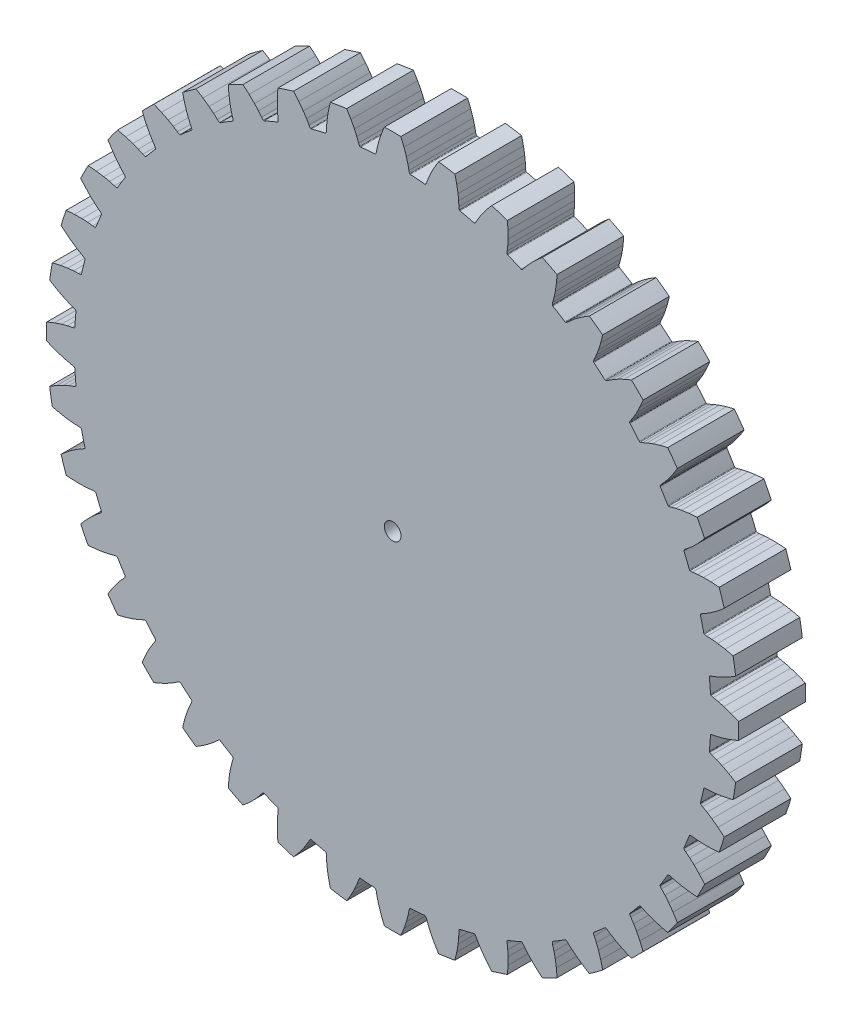
from build123d import *

# Parameters (mm, degrees)
BOSS_EXTRUDE1_DEPTH = 12.7
SKETCH2_R           = 1.5875
CUT_EXTRUDE1_DEPTH  = 95.06406823


with BuildPart() as part:
    # Model → Boss-Extrude1 (new body)
    with BuildSketch(Plane.XY):
        with BuildLine():
            ThreePointArc((60.432559989, -4.756145619), (60.482768647, -4.068159868), (60.525145286, -3.379647323))
            ThreePointArc((60.525145286, -3.379647323), (60.550130561, -3.301696422), (60.609923049, -3.245790562))
            ThreePointArc((60.609923049, -3.245790562), (60.826439878, -3.150337081), (61.055658386, -3.091602251))
            ThreePointArc((61.055658386, -3.091602251), (61.531607168, -3.002464951), (62.00435827, -2.897683768))
            ThreePointArc((62.00435827, -2.897683768), (62.546588484, -2.759880245), (63.084665609, -2.606660065))
            ThreePointArc((63.084665609, -2.606660065), (63.761308327, -2.391526525), (64.430648945, -2.154649038))
            ThreePointArc((64.430648945, -2.154649038), (65.162514979, -1.870027064), (65.885756381, -1.564152197))
            ThreePointArc((65.885756381, -1.564152197), (65.904320541, 0), (65.885756381, 1.564152197))
            ThreePointArc((65.885756381, 1.564152197), (65.162514976, 1.870027065), (64.430648939, 2.15464904))
            ThreePointArc((64.430648939, 2.15464904), (63.761308318, 2.391526528), (63.084665598, 2.606660069))
            ThreePointArc((63.084665598, 2.606660069), (62.546588471, 2.759880248), (62.004358256, 2.897683771))
            ThreePointArc((62.004358256, 2.897683771), (61.531607153, 3.002464954), (61.05565837, 3.091602254))
            ThreePointArc((61.05565837, 3.091602254), (60.82643988, 3.150337078), (60.609923065, 3.245790548))
            ThreePointArc((60.609923065, 3.245790548), (60.550130575, 3.301696402), (60.525145288, 3.379647296))
            ThreePointArc((60.525145288, 3.379647296), (60.43255999, 4.756145605), (60.308673633, 6.130180468))
            ThreePointArc((60.308673633, 6.130180468), (60.32115709, 6.211080222), (60.37146783, 6.275651394))
            ThreePointArc((60.37146783, 6.275651394), (60.570386763, 6.403800379), (60.78759506, 6.49766976))
            ThreePointArc((60.78759506, 6.49766976), (61.243739976, 6.660164425), (61.69427934, 6.837610144))
            ThreePointArc((61.69427934, 6.837610144), (62.20827658, 7.058540571), (62.715760166, 7.294048163))
            ThreePointArc((62.715760166, 7.294048163), (63.350417988, 7.612383294), (63.97446211, 7.951052367))
            ThreePointArc((63.97446211, 7.951052367), (64.652792972, 8.346659244), (65.319280701, 8.761908165))
            ThreePointArc((65.319280701, 8.761908165), (65.092928993, 10.309707128), (64.829906076, 11.851697941))
            ThreePointArc((64.829906076, 11.851697941), (64.067719602, 12.0406671), (63.300339364, 12.207295834))
            ThreePointArc((63.300339364, 12.207295834), (62.602183634, 12.336549025), (61.900217208, 12.443183673))
            ThreePointArc((61.900217208, 12.443183673), (61.344795787, 12.51034365), (60.787684105, 12.56162709))
            ThreePointArc((60.787684105, 12.56162709), (60.304361964, 12.591163676), (59.820328755, 12.604748755))
            ThreePointArc((59.820328755, 12.604748755), (59.584744174, 12.626902784), (59.355960828, 12.687310371))
            ThreePointArc((59.355960828, 12.687310371), (59.28815888, 12.733174325), (59.251286997, 12.806256954))
            ThreePointArc((59.251286997, 12.806256954), (58.944509801, 14.151324754), (58.607202282, 15.489062871))
            ThreePointArc((58.607202282, 15.489062871), (58.606876537, 15.570919457), (58.646466712, 15.642565985))
            ThreePointArc((58.646466712, 15.642565985), (58.822889705, 15.800255021), (59.0227394, 15.926947577))
            ThreePointArc((59.0227394, 15.926947577), (59.44784865, 16.158798449), (59.8650825, 16.404539401))
            ThreePointArc((59.8650825, 16.404539401), (60.338190448, 16.703156691), (60.802584565, 17.015152717))
            ThreePointArc((60.802584565, 17.015152717), (61.379630111, 17.428850971), (61.943011698, 17.860972475))
            ThreePointArc((61.943011698, 17.860972475), (62.551104632, 18.3578231), (63.144427548, 18.872221269))
            ThreePointArc((63.144427548, 18.872221269), (62.678733503, 20.36555505), (62.177728326, 21.847415549))
            ThreePointArc((62.177728326, 21.847415549), (61.395364343, 21.91482595), (60.611365352, 21.959358491))
            ThreePointArc((60.611365352, 21.959358491), (59.901585424, 21.977804742), (59.191580035, 21.973314798))
            ThreePointArc((59.191580035, 21.973314798), (58.632490638, 21.952760872), (58.074215428, 21.916261459))
            ThreePointArc((58.074215428, 21.916261459), (57.592223245, 21.869826161), (57.112024113, 21.807524509))
            ThreePointArc((57.112024113, 21.807524509), (56.875874316, 21.792552237), (56.640457844, 21.816426506))
            ThreePointArc((56.640457844, 21.816426506), (56.566315947, 21.851119237), (56.518465376, 21.917534065))
            ThreePointArc((56.518465376, 21.917534065), (56.005050155, 23.198051321), (55.462627105, 24.466553141))
            ThreePointArc((55.462627105, 24.466553141), (55.449500179, 24.547350979), (55.477394947, 24.624308687))
            ThreePointArc((55.477394947, 24.624308687), (55.62697788, 24.807654946), (55.804548012, 24.964051086))
            ThreePointArc((55.804548012, 24.964051086), (56.188153994, 25.259549228), (56.561808649, 25.567534455))
            ThreePointArc((56.561808649, 25.567534455), (56.982377817, 25.936485659), (57.39224754, 26.317287741))
            ThreePointArc((57.39224754, 26.317287741), (57.897472032, 26.816162495), (58.386318762, 27.331096163))
            ThreePointArc((58.386318762, 27.331096163), (58.9092005, 27.916956425), (59.414749024, 28.517837652))
            ThreePointArc((59.414749024, 28.517837652), (58.721179574, 29.919935417), (57.994528549, 31.305177278))
            ThreePointArc((57.994528549, 31.305177278), (57.211251454, 31.249369054), (56.429938368, 31.170708862))
            ThreePointArc((56.429938368, 31.170708862), (55.726011378, 31.077893966), (55.025449716, 30.962389988))
            ThreePointArc((55.025449716, 30.962389988), (54.47645898, 30.854628264), (53.930766831, 30.731244736))
            ThreePointArc((53.930766831, 30.731244736), (53.461972852, 30.609980944), (52.997431894, 30.473326634))
            ThreePointArc((52.997431894, 30.473326634), (52.766531672, 30.421596728), (52.530278809, 30.408349816))
            ThreePointArc((52.530278809, 30.408349816), (52.451622583, 30.431017074), (52.393971564, 30.489128746))
            ThreePointArc((52.393971564, 30.489128746), (51.686560304, 31.673564875), (50.952377978, 32.841595673))
            ThreePointArc((50.952377978, 32.841595673), (50.9267731, 32.919345252), (50.942285599, 32.999719186))
            ThreePointArc((50.942285599, 32.999719186), (51.061345244, 33.204208074), (51.212263446, 33.386456807))
            ThreePointArc((51.212263446, 33.386456807), (51.544920509, 33.738326073), (51.865795351, 34.100971957))
            ThreePointArc((51.865795351, 34.100971957), (52.22346993, 34.531172272), (52.568722907, 34.9714038))
            ThreePointArc((52.568722907, 34.9714038), (52.989686042, 35.5431711), (53.391960884, 36.128237557))
            ThreePointArc((53.391960884, 36.128237557), (53.816756344, 36.788681632), (54.222082193, 37.461250227))
            ThreePointArc((54.222082193, 37.461250227), (53.31771532, 38.737587676), (52.383311005, 39.992101646))
            ThreePointArc((52.383311005, 39.992101646), (51.618407681, 39.814448981), (50.859019021, 39.614532932))
            ThreePointArc((50.859019021, 39.614532932), (50.178277989, 39.4127423), (49.504410207, 39.189068378))
            ThreePointArc((49.504410207, 39.189068378), (48.979036105, 38.996752308), (48.459363768, 38.789522776))
            ThreePointArc((48.459363768, 38.789522776), (48.015311257, 38.596416407), (47.577867013, 38.388774323))
            ThreePointArc((47.577867013, 38.388774323), (47.357901896, 38.301560545), (47.126629971, 38.251518634))
            ThreePointArc((47.126629971, 38.251518634), (47.045396194, 38.261602276), (46.979364286, 38.309979891))
            ThreePointArc((46.979364286, 38.309979891), (46.095375801, 39.369170143), (45.187512204, 40.407969124))
            ThreePointArc((45.187512204, 40.407969124), (45.150059851, 40.480755991), (45.152808112, 40.562567078))
            ThreePointArc((45.152808112, 40.562567078), (45.238412826, 40.783163401), (45.358962991, 40.986777158))
            ThreePointArc((45.358962991, 40.986777158), (45.632480013, 41.386353359), (45.892674038, 41.794730354))
            ThreePointArc((45.892674038, 41.794730354), (46.178646894, 42.275586821), (46.45078185, 42.764407833))
            ThreePointArc((46.45078185, 42.764407833), (46.777118118, 43.394988872), (47.082915731, 44.03578184))
            ThreePointArc((47.082915731, 44.03578184), (47.399165039, 44.754547403), (47.694287746, 45.482242495))
            ThreePointArc((47.694287746, 45.482242495), (46.601391964, 46.601391964), (45.482242495, 47.694287746))
            ThreePointArc((45.482242495, 47.694287746), (44.7545474, 47.399165038), (44.035781834, 47.082915728))
            ThreePointArc((44.035781834, 47.082915728), (43.394988864, 46.777118114), (42.764407822, 46.450781844))
            ThreePointArc((42.764407822, 46.450781844), (42.275586809, 46.178646887), (41.794730341, 45.89267403))
            ThreePointArc((41.794730341, 45.89267403), (41.386353346, 45.632480004), (40.986777145, 45.358962982))
            ThreePointArc((40.986777145, 45.358962982), (40.783163404, 45.238412825), (40.5625671, 45.152808114))
            ThreePointArc((40.5625671, 45.152808114), (40.480756016, 45.150059846), (40.407969144, 45.187512186))
            ThreePointArc((40.407969144, 45.187512186), (39.369170163, 46.095375783), (38.309979911, 46.979364269))
            ThreePointArc((38.309979911, 46.979364269), (38.261602284, 47.04539617), (38.251518636, 47.12662995))
            ThreePointArc((38.251518636, 47.12662995), (38.301560546, 47.357901893), (38.38877433, 47.577867028))
            ThreePointArc((38.38877433, 47.577867028), (38.596416414, 48.015311271), (38.789522782, 48.459363781))
            ThreePointArc((38.789522782, 48.459363781), (38.996752313, 48.979036118), (39.189068382, 49.504410218))
            ThreePointArc((39.189068382, 49.504410218), (39.412742303, 50.178277998), (39.614532934, 50.859019027))
            ThreePointArc((39.614532934, 50.859019027), (39.814448982, 51.618407685), (39.992101646, 52.383311005))
            ThreePointArc((39.992101646, 52.383311005), (38.737587676, 53.31771532), (37.461250227, 54.222082193))
            ThreePointArc((37.461250227, 54.222082193), (36.788681629, 53.816756342), (36.128237552, 53.39196088))
            ThreePointArc((36.128237552, 53.39196088), (35.543171093, 52.989686036), (34.97140379, 52.568722899))
            ThreePointArc((34.97140379, 52.568722899), (34.531172261, 52.223469921), (34.100971945, 51.865795341))
            ThreePointArc((34.100971945, 51.865795341), (33.738326061, 51.544920498), (33.386456796, 51.212263435))
            ThreePointArc((33.386456796, 51.212263435), (33.204208077, 51.061345244), (32.999719207, 50.942285604))
            ThreePointArc((32.999719207, 50.942285604), (32.919345277, 50.926773099), (32.841595695, 50.952377963))
            ThreePointArc((32.841595695, 50.952377963), (31.673564898, 51.68656029), (30.48912877, 52.39397155))
            ThreePointArc((30.48912877, 52.39397155), (30.431017086, 52.451622561), (30.408349821, 52.530278788))
            ThreePointArc((30.408349821, 52.530278788), (30.42159673, 52.766531669), (30.473326639, 52.997431909))
            ThreePointArc((30.473326639, 52.997431909), (30.609980948, 53.461972867), (30.731244739, 53.930766845))
            ThreePointArc((30.731244739, 53.930766845), (30.854628267, 54.476458994), (30.96238999, 55.025449729))
            ThreePointArc((30.96238999, 55.025449729), (31.077893968, 55.726011388), (31.170708863, 56.429938375))
            ThreePointArc((31.170708863, 56.429938375), (31.249369054, 57.211251458), (31.305177278, 57.994528549))
            ThreePointArc((31.305177278, 57.994528549), (29.919935417, 58.721179574), (28.517837652, 59.414749024))
            ThreePointArc((28.517837652, 59.414749024), (27.916956423, 58.909200498), (27.331096158, 58.386318757))
            ThreePointArc((27.331096158, 58.386318757), (26.816162488, 57.897472026), (26.317287733, 57.392247531))
            ThreePointArc((26.317287733, 57.392247531), (25.93648565, 56.982377807), (25.567534445, 56.561808638))
            ThreePointArc((25.567534445, 56.561808638), (25.259549218, 56.188153982), (24.964051077, 55.804547999))
            ThreePointArc((24.964051077, 55.804547999), (24.807654948, 55.626977881), (24.624308707, 55.477394955))
            ThreePointArc((24.624308707, 55.477394955), (24.547351004, 55.449500182), (24.466553165, 55.462627094))
            ThreePointArc((24.466553165, 55.462627094), (23.198051346, 56.005050144), (21.91753409, 56.518465366))
            ThreePointArc((21.91753409, 56.518465366), (21.851119252, 56.566315927), (21.816426515, 56.640457824))
            ThreePointArc((21.816426515, 56.640457824), (21.792552239, 56.875874313), (21.807524511, 57.112024129))
            ThreePointArc((21.807524511, 57.112024129), (21.869826163, 57.59222326), (21.91626146, 58.074215443))
            ThreePointArc((21.91626146, 58.074215443), (21.952760873, 58.632490652), (21.973314799, 59.191580047))
            ThreePointArc((21.973314799, 59.191580047), (21.977804742, 59.901585433), (21.95935849, 60.611365359))
            ThreePointArc((21.95935849, 60.611365359), (21.91482595, 61.395364346), (21.847415549, 62.177728326))
            ThreePointArc((21.847415549, 62.177728326), (20.36555505, 62.678733503), (18.872221269, 63.144427548))
            ThreePointArc((18.872221269, 63.144427548), (18.357823098, 62.551104629), (17.860972471, 61.943011693))
            ThreePointArc((17.860972471, 61.943011693), (17.428850966, 61.379630103), (17.01515271, 60.802584555))
            ThreePointArc((17.01515271, 60.802584555), (16.703156684, 60.338190437), (16.404539394, 59.865082488))
            ThreePointArc((16.404539394, 59.865082488), (16.158798442, 59.447848637), (15.92694757, 59.022739386))
            ThreePointArc((15.92694757, 59.022739386), (15.800255024, 58.822889706), (15.642566004, 58.646466723))
            ThreePointArc((15.642566004, 58.646466723), (15.570919481, 58.606876544), (15.489062897, 58.607202275))
            ThreePointArc((15.489062897, 58.607202275), (14.15132478, 58.944509794), (12.806256981, 59.251286991))
            ThreePointArc((12.806256981, 59.251286991), (12.733174343, 59.288158863), (12.687310383, 59.35596081))
            ThreePointArc((12.687310383, 59.35596081), (12.626902786, 59.584744172), (12.604748755, 59.820328771))
            ThreePointArc((12.604748755, 59.820328771), (12.591163676, 60.304361979), (12.561627088, 60.78768412))
            ThreePointArc((12.561627088, 60.78768412), (12.510343649, 61.3447958), (12.443183671, 61.90021722))
            ThreePointArc((12.443183671, 61.90021722), (12.336549023, 62.602183643), (12.207295833, 63.300339371))
            ThreePointArc((12.207295833, 63.300339371), (12.040667099, 64.067719605), (11.851697941, 64.829906076))
            ThreePointArc((11.851697941, 64.829906076), (10.309707128, 65.092928993), (8.761908165, 65.319280701))
            ThreePointArc((8.761908165, 65.319280701), (8.346659242, 64.652792969), (7.951052364, 63.974462104))
            ThreePointArc((7.951052364, 63.974462104), (7.612383289, 63.35041798), (7.294048157, 62.715760155))
            ThreePointArc((7.294048157, 62.715760155), (7.058540565, 62.208276567), (6.837610138, 61.694279326))
            ThreePointArc((6.837610138, 61.694279326), (6.66016442, 61.243739962), (6.497669755, 60.787595044))
            ThreePointArc((6.497669755, 60.787595044), (6.403800382, 60.570386765), (6.27565141, 60.371467844))
            ThreePointArc((6.27565141, 60.371467844), (6.211080244, 60.3211571), (6.130180495, 60.30867363))
            ThreePointArc((6.130180495, 60.30867363), (4.756145632, 60.432559988), (3.379647323, 60.525145286))
            ThreePointArc((3.379647323, 60.525145286), (3.301696422, 60.550130561), (3.245790562, 60.609923049))
            ThreePointArc((3.245790562, 60.609923049), (3.150337081, 60.826439878), (3.091602251, 61.055658386))
            ThreePointArc((3.091602251, 61.055658386), (3.002464951, 61.531607168), (2.897683768, 62.00435827))
            ThreePointArc((2.897683768, 62.00435827), (2.759880245, 62.546588484), (2.606660065, 63.084665609))
            ThreePointArc((2.606660065, 63.084665609), (2.391526525, 63.761308327), (2.154649038, 64.430648945))
            ThreePointArc((2.154649038, 64.430648945), (1.870027064, 65.162514979), (1.564152197, 65.885756381))
            ThreePointArc((1.564152197, 65.885756381), (0, 65.904320541), (-1.564152197, 65.885756381))
            ThreePointArc((-1.564152197, 65.885756381), (-1.870027065, 65.162514976), (-2.15464904, 64.430648939))
            ThreePointArc((-2.15464904, 64.430648939), (-2.391526528, 63.761308318), (-2.606660069, 63.084665598))
            ThreePointArc((-2.606660069, 63.084665598), (-2.759880248, 62.546588471), (-2.897683771, 62.004358256))
            ThreePointArc((-2.897683771, 62.004358256), (-3.002464954, 61.531607153), (-3.091602254, 61.05565837))
            ThreePointArc((-3.091602254, 61.05565837), (-3.150337078, 60.82643988), (-3.245790548, 60.609923065))
            ThreePointArc((-3.245790548, 60.609923065), (-3.301696402, 60.550130575), (-3.379647296, 60.525145288))
            ThreePointArc((-3.379647296, 60.525145288), (-4.756145605, 60.43255999), (-6.130180468, 60.308673633))
            ThreePointArc((-6.130180468, 60.308673633), (-6.211080222, 60.32115709), (-6.275651394, 60.37146783))
            ThreePointArc((-6.275651394, 60.37146783), (-6.403800379, 60.570386763), (-6.49766976, 60.78759506))
            ThreePointArc((-6.49766976, 60.78759506), (-6.660164425, 61.243739976), (-6.837610144, 61.69427934))
            ThreePointArc((-6.837610144, 61.69427934), (-7.058540571, 62.20827658), (-7.294048163, 62.715760166))
            ThreePointArc((-7.294048163, 62.715760166), (-7.612383294, 63.350417988), (-7.951052367, 63.97446211))
            ThreePointArc((-7.951052367, 63.97446211), (-8.346659244, 64.652792972), (-8.761908165, 65.319280701))
            ThreePointArc((-8.761908165, 65.319280701), (-10.309707128, 65.092928993), (-11.851697941, 64.829906076))
            ThreePointArc((-11.851697941, 64.829906076), (-12.0406671, 64.067719602), (-12.207295834, 63.300339364))
            ThreePointArc((-12.207295834, 63.300339364), (-12.336549025, 62.602183634), (-12.443183673, 61.900217208))
            ThreePointArc((-12.443183673, 61.900217208), (-12.51034365, 61.344795787), (-12.56162709, 60.787684105))
            ThreePointArc((-12.56162709, 60.787684105), (-12.591163676, 60.304361964), (-12.604748755, 59.820328755))
            ThreePointArc((-12.604748755, 59.820328755), (-12.626902784, 59.584744174), (-12.687310371, 59.355960828))
            ThreePointArc((-12.687310371, 59.355960828), (-12.733174325, 59.28815888), (-12.806256954, 59.251286997))
            ThreePointArc((-12.806256954, 59.251286997), (-14.151324754, 58.944509801), (-15.489062871, 58.607202282))
            ThreePointArc((-15.489062871, 58.607202282), (-15.570919457, 58.606876537), (-15.642565985, 58.646466712))
            ThreePointArc((-15.642565985, 58.646466712), (-15.800255021, 58.822889705), (-15.926947577, 59.0227394))
            ThreePointArc((-15.926947577, 59.0227394), (-16.158798449, 59.44784865), (-16.404539401, 59.8650825))
            ThreePointArc((-16.404539401, 59.8650825), (-16.703156691, 60.338190448), (-17.015152717, 60.802584565))
            ThreePointArc((-17.015152717, 60.802584565), (-17.428850971, 61.379630111), (-17.860972475, 61.943011698))
            ThreePointArc((-17.860972475, 61.943011698), (-18.3578231, 62.551104632), (-18.872221269, 63.144427548))
            ThreePointArc((-18.872221269, 63.144427548), (-20.36555505, 62.678733503), (-21.847415549, 62.177728326))
            ThreePointArc((-21.847415549, 62.177728326), (-21.91482595, 61.395364343), (-21.959358491, 60.611365352))
            ThreePointArc((-21.959358491, 60.611365352), (-21.977804742, 59.901585424), (-21.973314798, 59.191580035))
            ThreePointArc((-21.973314798, 59.191580035), (-21.952760872, 58.632490638), (-21.916261459, 58.074215428))
            ThreePointArc((-21.916261459, 58.074215428), (-21.869826161, 57.592223245), (-21.807524509, 57.112024113))
            ThreePointArc((-21.807524509, 57.112024113), (-21.792552237, 56.875874316), (-21.816426506, 56.640457844))
            ThreePointArc((-21.816426506, 56.640457844), (-21.851119237, 56.566315947), (-21.917534065, 56.518465376))
            ThreePointArc((-21.917534065, 56.518465376), (-23.198051321, 56.005050155), (-24.466553141, 55.462627105))
            ThreePointArc((-24.466553141, 55.462627105), (-24.547350979, 55.449500179), (-24.624308687, 55.477394947))
            ThreePointArc((-24.624308687, 55.477394947), (-24.807654946, 55.62697788), (-24.964051086, 55.804548012))
            ThreePointArc((-24.964051086, 55.804548012), (-25.259549228, 56.188153994), (-25.567534455, 56.561808649))
            ThreePointArc((-25.567534455, 56.561808649), (-25.936485659, 56.982377817), (-26.317287741, 57.39224754))
            ThreePointArc((-26.317287741, 57.39224754), (-26.816162495, 57.897472032), (-27.331096163, 58.386318762))
            ThreePointArc((-27.331096163, 58.386318762), (-27.916956425, 58.9092005), (-28.517837652, 59.414749024))
            ThreePointArc((-28.517837652, 59.414749024), (-29.919935417, 58.721179574), (-31.305177278, 57.994528549))
            ThreePointArc((-31.305177278, 57.994528549), (-31.249369054, 57.211251454), (-31.170708862, 56.429938368))
            ThreePointArc((-31.170708862, 56.429938368), (-31.077893966, 55.726011378), (-30.962389988, 55.025449716))
            ThreePointArc((-30.962389988, 55.025449716), (-30.854628264, 54.47645898), (-30.731244736, 53.930766831))
            ThreePointArc((-30.731244736, 53.930766831), (-30.609980944, 53.461972852), (-30.473326634, 52.997431894))
            ThreePointArc((-30.473326634, 52.997431894), (-30.421596728, 52.766531672), (-30.408349816, 52.530278809))
            ThreePointArc((-30.408349816, 52.530278809), (-30.431017074, 52.451622583), (-30.489128746, 52.393971564))
            ThreePointArc((-30.489128746, 52.393971564), (-31.673564875, 51.686560304), (-32.841595673, 50.952377978))
            ThreePointArc((-32.841595673, 50.952377978), (-32.919345252, 50.9267731), (-32.999719186, 50.942285599))
            ThreePointArc((-32.999719186, 50.942285599), (-33.204208074, 51.061345244), (-33.386456807, 51.212263446))
            ThreePointArc((-33.386456807, 51.212263446), (-33.738326073, 51.544920509), (-34.100971957, 51.865795351))
            ThreePointArc((-34.100971957, 51.865795351), (-34.531172272, 52.22346993), (-34.9714038, 52.568722907))
            ThreePointArc((-34.9714038, 52.568722907), (-35.5431711, 52.989686042), (-36.128237557, 53.391960884))
            ThreePointArc((-36.128237557, 53.391960884), (-36.788681632, 53.816756344), (-37.461250227, 54.222082193))
            ThreePointArc((-37.461250227, 54.222082193), (-38.737587676, 53.31771532), (-39.992101646, 52.383311005))
            ThreePointArc((-39.992101646, 52.383311005), (-39.814448981, 51.618407681), (-39.614532932, 50.859019021))
            ThreePointArc((-39.614532932, 50.859019021), (-39.4127423, 50.178277989), (-39.189068378, 49.504410207))
            ThreePointArc((-39.189068378, 49.504410207), (-38.996752308, 48.979036105), (-38.789522776, 48.459363768))
            ThreePointArc((-38.789522776, 48.459363768), (-38.596416407, 48.015311257), (-38.388774323, 47.577867013))
            ThreePointArc((-38.388774323, 47.577867013), (-38.301560545, 47.357901896), (-38.251518634, 47.126629971))
            ThreePointArc((-38.251518634, 47.126629971), (-38.261602276, 47.045396194), (-38.309979891, 46.979364286))
            ThreePointArc((-38.309979891, 46.979364286), (-39.369170143, 46.095375801), (-40.407969124, 45.187512204))
            ThreePointArc((-40.407969124, 45.187512204), (-40.480755991, 45.150059851), (-40.562567078, 45.152808112))
            ThreePointArc((-40.562567078, 45.152808112), (-40.783163401, 45.238412826), (-40.986777158, 45.358962991))
            ThreePointArc((-40.986777158, 45.358962991), (-41.386353359, 45.632480013), (-41.794730354, 45.892674038))
            ThreePointArc((-41.794730354, 45.892674038), (-42.275586821, 46.178646894), (-42.764407833, 46.45078185))
            ThreePointArc((-42.764407833, 46.45078185), (-43.394988872, 46.777118118), (-44.03578184, 47.082915731))
            ThreePointArc((-44.03578184, 47.082915731), (-44.754547403, 47.399165039), (-45.482242495, 47.694287746))
            ThreePointArc((-45.482242495, 47.694287746), (-46.601391964, 46.601391964), (-47.694287746, 45.482242495))
            ThreePointArc((-47.694287746, 45.482242495), (-47.399165038, 44.7545474), (-47.082915728, 44.035781834))
            ThreePointArc((-47.082915728, 44.035781834), (-46.777118114, 43.394988864), (-46.450781844, 42.764407822))
            ThreePointArc((-46.450781844, 42.764407822), (-46.178646887, 42.275586809), (-45.89267403, 41.794730341))
            ThreePointArc((-45.89267403, 41.794730341), (-45.632480004, 41.386353346), (-45.358962982, 40.986777145))
            ThreePointArc((-45.358962982, 40.986777145), (-45.238412825, 40.783163404), (-45.152808114, 40.5625671))
            ThreePointArc((-45.152808114, 40.5625671), (-45.150059846, 40.480756016), (-45.187512186, 40.407969144))
            ThreePointArc((-45.187512186, 40.407969144), (-46.095375783, 39.369170163), (-46.979364269, 38.309979911))
            ThreePointArc((-46.979364269, 38.309979911), (-47.04539617, 38.261602284), (-47.12662995, 38.251518636))
            ThreePointArc((-47.12662995, 38.251518636), (-47.357901893, 38.301560546), (-47.577867028, 38.38877433))
            ThreePointArc((-47.577867028, 38.38877433), (-48.015311271, 38.596416414), (-48.459363781, 38.789522782))
            ThreePointArc((-48.459363781, 38.789522782), (-48.979036118, 38.996752313), (-49.504410218, 39.189068382))
            ThreePointArc((-49.504410218, 39.189068382), (-50.178277998, 39.412742303), (-50.859019027, 39.614532934))
            ThreePointArc((-50.859019027, 39.614532934), (-51.618407685, 39.814448982), (-52.383311005, 39.992101646))
            ThreePointArc((-52.383311005, 39.992101646), (-53.31771532, 38.737587676), (-54.222082193, 37.461250227))
            ThreePointArc((-54.222082193, 37.461250227), (-53.816756342, 36.788681629), (-53.39196088, 36.128237552))
            ThreePointArc((-53.39196088, 36.128237552), (-52.989686036, 35.543171093), (-52.568722899, 34.97140379))
            ThreePointArc((-52.568722899, 34.97140379), (-52.223469921, 34.531172261), (-51.865795341, 34.100971945))
            ThreePointArc((-51.865795341, 34.100971945), (-51.544920498, 33.738326061), (-51.212263435, 33.386456796))
            ThreePointArc((-51.212263435, 33.386456796), (-51.061345244, 33.204208077), (-50.942285604, 32.999719207))
            ThreePointArc((-50.942285604, 32.999719207), (-50.926773099, 32.919345277), (-50.952377963, 32.841595695))
            ThreePointArc((-50.952377963, 32.841595695), (-51.68656029, 31.673564898), (-52.39397155, 30.48912877))
            ThreePointArc((-52.39397155, 30.48912877), (-52.451622561, 30.431017086), (-52.530278788, 30.408349821))
            ThreePointArc((-52.530278788, 30.408349821), (-52.766531669, 30.42159673), (-52.997431909, 30.473326639))
            ThreePointArc((-52.997431909, 30.473326639), (-53.461972867, 30.609980948), (-53.930766845, 30.731244739))
            ThreePointArc((-53.930766845, 30.731244739), (-54.476458994, 30.854628267), (-55.025449729, 30.96238999))
            ThreePointArc((-55.025449729, 30.96238999), (-55.726011388, 31.077893968), (-56.429938375, 31.170708863))
            ThreePointArc((-56.429938375, 31.170708863), (-57.211251458, 31.249369054), (-57.994528549, 31.305177278))
            ThreePointArc((-57.994528549, 31.305177278), (-58.721179574, 29.919935417), (-59.414749024, 28.517837652))
            ThreePointArc((-59.414749024, 28.517837652), (-58.909200498, 27.916956423), (-58.386318757, 27.331096158))
            ThreePointArc((-58.386318757, 27.331096158), (-57.897472026, 26.816162488), (-57.392247531, 26.317287733))
            ThreePointArc((-57.392247531, 26.317287733), (-56.982377807, 25.93648565), (-56.561808638, 25.567534445))
            ThreePointArc((-56.561808638, 25.567534445), (-56.188153982, 25.259549218), (-55.804547999, 24.964051077))
            ThreePointArc((-55.804547999, 24.964051077), (-55.626977881, 24.807654948), (-55.477394955, 24.624308707))
            ThreePointArc((-55.477394955, 24.624308707), (-55.449500182, 24.547351004), (-55.462627094, 24.466553165))
            ThreePointArc((-55.462627094, 24.466553165), (-56.005050144, 23.198051346), (-56.518465366, 21.91753409))
            ThreePointArc((-56.518465366, 21.91753409), (-56.566315927, 21.851119252), (-56.640457824, 21.816426515))
            ThreePointArc((-56.640457824, 21.816426515), (-56.875874313, 21.792552239), (-57.112024129, 21.807524511))
            ThreePointArc((-57.112024129, 21.807524511), (-57.59222326, 21.869826163), (-58.074215443, 21.91626146))
            ThreePointArc((-58.074215443, 21.91626146), (-58.632490652, 21.952760873), (-59.191580047, 21.973314799))
            ThreePointArc((-59.191580047, 21.973314799), (-59.901585433, 21.977804742), (-60.611365359, 21.95935849))
            ThreePointArc((-60.611365359, 21.95935849), (-61.395364346, 21.91482595), (-62.177728326, 21.847415549))
            ThreePointArc((-62.177728326, 21.847415549), (-62.678733503, 20.36555505), (-63.144427548, 18.872221269))
            ThreePointArc((-63.144427548, 18.872221269), (-62.551104629, 18.357823098), (-61.943011693, 17.860972471))
            ThreePointArc((-61.943011693, 17.860972471), (-61.379630103, 17.428850966), (-60.802584555, 17.01515271))
            ThreePointArc((-60.802584555, 17.01515271), (-60.338190437, 16.703156684), (-59.865082488, 16.404539394))
            ThreePointArc((-59.865082488, 16.404539394), (-59.447848637, 16.158798442), (-59.022739386, 15.92694757))
            ThreePointArc((-59.022739386, 15.92694757), (-58.822889706, 15.800255024), (-58.646466723, 15.642566004))
            ThreePointArc((-58.646466723, 15.642566004), (-58.606876544, 15.570919481), (-58.607202275, 15.489062897))
            ThreePointArc((-58.607202275, 15.489062897), (-58.944509794, 14.15132478), (-59.251286991, 12.806256981))
            ThreePointArc((-59.251286991, 12.806256981), (-59.288158863, 12.733174343), (-59.35596081, 12.687310383))
            ThreePointArc((-59.35596081, 12.687310383), (-59.584744172, 12.626902786), (-59.820328771, 12.604748755))
            ThreePointArc((-59.820328771, 12.604748755), (-60.304361979, 12.591163676), (-60.78768412, 12.561627088))
            ThreePointArc((-60.78768412, 12.561627088), (-61.3447958, 12.510343649), (-61.90021722, 12.443183671))
            ThreePointArc((-61.90021722, 12.443183671), (-62.602183643, 12.336549023), (-63.300339371, 12.207295833))
            ThreePointArc((-63.300339371, 12.207295833), (-64.067719605, 12.040667099), (-64.829906076, 11.851697941))
            ThreePointArc((-64.829906076, 11.851697941), (-65.092928993, 10.309707128), (-65.319280701, 8.761908165))
            ThreePointArc((-65.319280701, 8.761908165), (-64.652792969, 8.346659242), (-63.974462104, 7.951052364))
            ThreePointArc((-63.974462104, 7.951052364), (-63.35041798, 7.612383289), (-62.715760155, 7.294048157))
            ThreePointArc((-62.715760155, 7.294048157), (-62.208276567, 7.058540565), (-61.694279326, 6.837610138))
            ThreePointArc((-61.694279326, 6.837610138), (-61.243739962, 6.66016442), (-60.787595044, 6.497669755))
            ThreePointArc((-60.787595044, 6.497669755), (-60.570386765, 6.403800382), (-60.371467844, 6.27565141))
            ThreePointArc((-60.371467844, 6.27565141), (-60.3211571, 6.211080244), (-60.30867363, 6.130180495))
            ThreePointArc((-60.30867363, 6.130180495), (-60.432559988, 4.756145632), (-60.525145286, 3.379647323))
            ThreePointArc((-60.525145286, 3.379647323), (-60.550130561, 3.301696422), (-60.609923049, 3.245790562))
            ThreePointArc((-60.609923049, 3.245790562), (-60.826439878, 3.150337081), (-61.055658386, 3.091602251))
            ThreePointArc((-61.055658386, 3.091602251), (-61.531607168, 3.002464951), (-62.00435827, 2.897683768))
            ThreePointArc((-62.00435827, 2.897683768), (-62.546588484, 2.759880245), (-63.084665609, 2.606660065))
            ThreePointArc((-63.084665609, 2.606660065), (-63.761308327, 2.391526525), (-64.430648945, 2.154649038))
            ThreePointArc((-64.430648945, 2.154649038), (-65.162514979, 1.870027064), (-65.885756381, 1.564152197))
            ThreePointArc((-65.885756381, 1.564152197), (-65.904320541, 0), (-65.885756381, -1.564152197))
            ThreePointArc((-65.885756381, -1.564152197), (-65.162514976, -1.870027065), (-64.430648939, -2.15464904))
            ThreePointArc((-64.430648939, -2.15464904), (-63.761308318, -2.391526528), (-63.084665598, -2.606660069))
            ThreePointArc((-63.084665598, -2.606660069), (-62.546588471, -2.759880248), (-62.004358256, -2.897683771))
            ThreePointArc((-62.004358256, -2.897683771), (-61.531607153, -3.002464954), (-61.05565837, -3.091602254))
            ThreePointArc((-61.05565837, -3.091602254), (-60.82643988, -3.150337078), (-60.609923065, -3.245790548))
            ThreePointArc((-60.609923065, -3.245790548), (-60.550130575, -3.301696402), (-60.525145288, -3.379647296))
            ThreePointArc((-60.525145288, -3.379647296), (-60.43255999, -4.756145605), (-60.308673633, -6.130180468))
            ThreePointArc((-60.308673633, -6.130180468), (-60.32115709, -6.211080222), (-60.37146783, -6.275651394))
            ThreePointArc((-60.37146783, -6.275651394), (-60.570386763, -6.403800379), (-60.78759506, -6.49766976))
            ThreePointArc((-60.78759506, -6.49766976), (-61.243739976, -6.660164425), (-61.69427934, -6.837610144))
            ThreePointArc((-61.69427934, -6.837610144), (-62.20827658, -7.058540571), (-62.715760166, -7.294048163))
            ThreePointArc((-62.715760166, -7.294048163), (-63.350417988, -7.612383294), (-63.97446211, -7.951052367))
            ThreePointArc((-63.97446211, -7.951052367), (-64.652792972, -8.346659244), (-65.319280701, -8.761908165))
            ThreePointArc((-65.319280701, -8.761908165), (-65.092928993, -10.309707128), (-64.829906076, -11.851697941))
            ThreePointArc((-64.829906076, -11.851697941), (-64.067719602, -12.0406671), (-63.300339364, -12.207295834))
            ThreePointArc((-63.300339364, -12.207295834), (-62.602183634, -12.336549025), (-61.900217208, -12.443183673))
            ThreePointArc((-61.900217208, -12.443183673), (-61.344795787, -12.51034365), (-60.787684105, -12.56162709))
            ThreePointArc((-60.787684105, -12.56162709), (-60.304361964, -12.591163676), (-59.820328755, -12.604748755))
            ThreePointArc((-59.820328755, -12.604748755), (-59.584744174, -12.626902784), (-59.355960828, -12.687310371))
            ThreePointArc((-59.355960828, -12.687310371), (-59.28815888, -12.733174325), (-59.251286997, -12.806256954))
            ThreePointArc((-59.251286997, -12.806256954), (-58.944509801, -14.151324754), (-58.607202282, -15.489062871))
            ThreePointArc((-58.607202282, -15.489062871), (-58.606876537, -15.570919457), (-58.646466712, -15.642565985))
            ThreePointArc((-58.646466712, -15.642565985), (-58.822889705, -15.800255021), (-59.0227394, -15.926947577))
            ThreePointArc((-59.0227394, -15.926947577), (-59.44784865, -16.158798449), (-59.8650825, -16.404539401))
            ThreePointArc((-59.8650825, -16.404539401), (-60.338190448, -16.703156691), (-60.802584565, -17.015152717))
            ThreePointArc((-60.802584565, -17.015152717), (-61.379630111, -17.428850971), (-61.943011698, -17.860972475))
            ThreePointArc((-61.943011698, -17.860972475), (-62.551104632, -18.3578231), (-63.144427548, -18.872221269))
            ThreePointArc((-63.144427548, -18.872221269), (-62.678733503, -20.36555505), (-62.177728326, -21.847415549))
            ThreePointArc((-62.177728326, -21.847415549), (-61.395364343, -21.91482595), (-60.611365352, -21.959358491))
            ThreePointArc((-60.611365352, -21.959358491), (-59.901585424, -21.977804742), (-59.191580035, -21.973314798))
            ThreePointArc((-59.191580035, -21.973314798), (-58.632490638, -21.952760872), (-58.074215428, -21.916261459))
            ThreePointArc((-58.074215428, -21.916261459), (-57.592223245, -21.869826161), (-57.112024113, -21.807524509))
            ThreePointArc((-57.112024113, -21.807524509), (-56.875874316, -21.792552237), (-56.640457844, -21.816426506))
            ThreePointArc((-56.640457844, -21.816426506), (-56.566315947, -21.851119237), (-56.518465376, -21.917534065))
            ThreePointArc((-56.518465376, -21.917534065), (-56.005050155, -23.198051321), (-55.462627105, -24.466553141))
            ThreePointArc((-55.462627105, -24.466553141), (-55.449500179, -24.547350979), (-55.477394947, -24.624308687))
            ThreePointArc((-55.477394947, -24.624308687), (-55.62697788, -24.807654946), (-55.804548012, -24.964051086))
            ThreePointArc((-55.804548012, -24.964051086), (-56.188153994, -25.259549228), (-56.561808649, -25.567534455))
            ThreePointArc((-56.561808649, -25.567534455), (-56.982377817, -25.936485659), (-57.39224754, -26.317287741))
            ThreePointArc((-57.39224754, -26.317287741), (-57.897472032, -26.816162495), (-58.386318762, -27.331096163))
            ThreePointArc((-58.386318762, -27.331096163), (-58.9092005, -27.916956425), (-59.414749024, -28.517837652))
            ThreePointArc((-59.414749024, -28.517837652), (-58.721179574, -29.919935417), (-57.994528549, -31.305177278))
            ThreePointArc((-57.994528549, -31.305177278), (-57.211251454, -31.249369054), (-56.429938368, -31.170708862))
            ThreePointArc((-56.429938368, -31.170708862), (-55.726011378, -31.077893966), (-55.025449716, -30.962389988))
            ThreePointArc((-55.025449716, -30.962389988), (-54.47645898, -30.854628264), (-53.930766831, -30.731244736))
            ThreePointArc((-53.930766831, -30.731244736), (-53.461972852, -30.609980944), (-52.997431894, -30.473326634))
            ThreePointArc((-52.997431894, -30.473326634), (-52.766531672, -30.421596728), (-52.530278809, -30.408349816))
            ThreePointArc((-52.530278809, -30.408349816), (-52.451622583, -30.431017074), (-52.393971564, -30.489128746))
            ThreePointArc((-52.393971564, -30.489128746), (-51.686560304, -31.673564875), (-50.952377978, -32.841595673))
            ThreePointArc((-50.952377978, -32.841595673), (-50.9267731, -32.919345252), (-50.942285599, -32.999719186))
            ThreePointArc((-50.942285599, -32.999719186), (-51.061345244, -33.204208074), (-51.212263446, -33.386456807))
            ThreePointArc((-51.212263446, -33.386456807), (-51.544920509, -33.738326073), (-51.865795351, -34.100971957))
            ThreePointArc((-51.865795351, -34.100971957), (-52.22346993, -34.531172272), (-52.568722907, -34.9714038))
            ThreePointArc((-52.568722907, -34.9714038), (-52.989686042, -35.5431711), (-53.391960884, -36.128237557))
            ThreePointArc((-53.391960884, -36.128237557), (-53.816756344, -36.788681632), (-54.222082193, -37.461250227))
            ThreePointArc((-54.222082193, -37.461250227), (-53.31771532, -38.737587676), (-52.383311005, -39.992101646))
            ThreePointArc((-52.383311005, -39.992101646), (-51.618407681, -39.814448981), (-50.859019021, -39.614532932))
            ThreePointArc((-50.859019021, -39.614532932), (-50.178277989, -39.4127423), (-49.504410207, -39.189068378))
            ThreePointArc((-49.504410207, -39.189068378), (-48.979036105, -38.996752308), (-48.459363768, -38.789522776))
            ThreePointArc((-48.459363768, -38.789522776), (-48.015311257, -38.596416407), (-47.577867013, -38.388774323))
            ThreePointArc((-47.577867013, -38.388774323), (-47.357901896, -38.301560545), (-47.126629971, -38.251518634))
            ThreePointArc((-47.126629971, -38.251518634), (-47.045396194, -38.261602276), (-46.979364286, -38.309979891))
            ThreePointArc((-46.979364286, -38.309979891), (-46.095375801, -39.369170143), (-45.187512204, -40.407969124))
            ThreePointArc((-45.187512204, -40.407969124), (-45.150059851, -40.480755991), (-45.152808112, -40.562567078))
            ThreePointArc((-45.152808112, -40.562567078), (-45.238412826, -40.783163401), (-45.358962991, -40.986777158))
            ThreePointArc((-45.358962991, -40.986777158), (-45.632480013, -41.386353359), (-45.892674038, -41.794730354))
            ThreePointArc((-45.892674038, -41.794730354), (-46.178646894, -42.275586821), (-46.45078185, -42.764407833))
            ThreePointArc((-46.45078185, -42.764407833), (-46.777118118, -43.394988872), (-47.082915731, -44.03578184))
            ThreePointArc((-47.082915731, -44.03578184), (-47.399165039, -44.754547403), (-47.694287746, -45.482242495))
            ThreePointArc((-47.694287746, -45.482242495), (-46.601391964, -46.601391964), (-45.482242495, -47.694287746))
            ThreePointArc((-45.482242495, -47.694287746), (-44.7545474, -47.399165038), (-44.035781834, -47.082915728))
            ThreePointArc((-44.035781834, -47.082915728), (-43.394988864, -46.777118114), (-42.764407822, -46.450781844))
            ThreePointArc((-42.764407822, -46.450781844), (-42.275586809, -46.178646887), (-41.794730341, -45.89267403))
            ThreePointArc((-41.794730341, -45.89267403), (-41.386353346, -45.632480004), (-40.986777145, -45.358962982))
            ThreePointArc((-40.986777145, -45.358962982), (-40.783163404, -45.238412825), (-40.5625671, -45.152808114))
            ThreePointArc((-40.5625671, -45.152808114), (-40.480756016, -45.150059846), (-40.407969144, -45.187512186))
            ThreePointArc((-40.407969144, -45.187512186), (-39.369170163, -46.095375783), (-38.309979911, -46.979364269))
            ThreePointArc((-38.309979911, -46.979364269), (-38.261602284, -47.04539617), (-38.251518636, -47.12662995))
            ThreePointArc((-38.251518636, -47.12662995), (-38.301560546, -47.357901893), (-38.38877433, -47.577867028))
            ThreePointArc((-38.38877433, -47.577867028), (-38.596416414, -48.015311271), (-38.789522782, -48.459363781))
            ThreePointArc((-38.789522782, -48.459363781), (-38.996752313, -48.979036118), (-39.189068382, -49.504410218))
            ThreePointArc((-39.189068382, -49.504410218), (-39.412742303, -50.178277998), (-39.614532934, -50.859019027))
            ThreePointArc((-39.614532934, -50.859019027), (-39.814448982, -51.618407685), (-39.992101646, -52.383311005))
            ThreePointArc((-39.992101646, -52.383311005), (-38.737587676, -53.31771532), (-37.461250227, -54.222082193))
            ThreePointArc((-37.461250227, -54.222082193), (-36.788681629, -53.816756342), (-36.128237552, -53.39196088))
            ThreePointArc((-36.128237552, -53.39196088), (-35.543171093, -52.989686036), (-34.97140379, -52.568722899))
            ThreePointArc((-34.97140379, -52.568722899), (-34.531172261, -52.223469921), (-34.100971945, -51.865795341))
            ThreePointArc((-34.100971945, -51.865795341), (-33.738326061, -51.544920498), (-33.386456796, -51.212263435))
            ThreePointArc((-33.386456796, -51.212263435), (-33.204208077, -51.061345244), (-32.999719207, -50.942285604))
            ThreePointArc((-32.999719207, -50.942285604), (-32.919345277, -50.926773099), (-32.841595695, -50.952377963))
            ThreePointArc((-32.841595695, -50.952377963), (-31.673564898, -51.68656029), (-30.48912877, -52.39397155))
            ThreePointArc((-30.48912877, -52.39397155), (-30.431017086, -52.451622561), (-30.408349821, -52.530278788))
            ThreePointArc((-30.408349821, -52.530278788), (-30.42159673, -52.766531669), (-30.473326639, -52.997431909))
            ThreePointArc((-30.473326639, -52.997431909), (-30.609980948, -53.461972867), (-30.731244739, -53.930766845))
            ThreePointArc((-30.731244739, -53.930766845), (-30.854628267, -54.476458994), (-30.96238999, -55.025449729))
            ThreePointArc((-30.96238999, -55.025449729), (-31.077893968, -55.726011388), (-31.170708863, -56.429938375))
            ThreePointArc((-31.170708863, -56.429938375), (-31.249369054, -57.211251458), (-31.305177278, -57.994528549))
            ThreePointArc((-31.305177278, -57.994528549), (-29.919935417, -58.721179574), (-28.517837652, -59.414749024))
            ThreePointArc((-28.517837652, -59.414749024), (-27.916956423, -58.909200498), (-27.331096158, -58.386318757))
            ThreePointArc((-27.331096158, -58.386318757), (-26.816162488, -57.897472026), (-26.317287733, -57.392247531))
            ThreePointArc((-26.317287733, -57.392247531), (-25.93648565, -56.982377807), (-25.567534445, -56.561808638))
            ThreePointArc((-25.567534445, -56.561808638), (-25.259549218, -56.188153982), (-24.964051077, -55.804547999))
            ThreePointArc((-24.964051077, -55.804547999), (-24.807654948, -55.626977881), (-24.624308707, -55.477394955))
            ThreePointArc((-24.624308707, -55.477394955), (-24.547351004, -55.449500182), (-24.466553165, -55.462627094))
            ThreePointArc((-24.466553165, -55.462627094), (-23.198051346, -56.005050144), (-21.91753409, -56.518465366))
            ThreePointArc((-21.91753409, -56.518465366), (-21.851119252, -56.566315927), (-21.816426515, -56.640457824))
            ThreePointArc((-21.816426515, -56.640457824), (-21.792552239, -56.875874313), (-21.807524511, -57.112024129))
            ThreePointArc((-21.807524511, -57.112024129), (-21.869826163, -57.59222326), (-21.91626146, -58.074215443))
            ThreePointArc((-21.91626146, -58.074215443), (-21.952760873, -58.632490652), (-21.973314799, -59.191580047))
            ThreePointArc((-21.973314799, -59.191580047), (-21.977804742, -59.901585433), (-21.95935849, -60.611365359))
            ThreePointArc((-21.95935849, -60.611365359), (-21.91482595, -61.395364346), (-21.847415549, -62.177728326))
            ThreePointArc((-21.847415549, -62.177728326), (-20.36555505, -62.678733503), (-18.872221269, -63.144427548))
            ThreePointArc((-18.872221269, -63.144427548), (-18.357823098, -62.551104629), (-17.860972471, -61.943011693))
            ThreePointArc((-17.860972471, -61.943011693), (-17.428850966, -61.379630103), (-17.01515271, -60.802584555))
            ThreePointArc((-17.01515271, -60.802584555), (-16.703156684, -60.338190437), (-16.404539394, -59.865082488))
            ThreePointArc((-16.404539394, -59.865082488), (-16.158798442, -59.447848637), (-15.92694757, -59.022739386))
            ThreePointArc((-15.92694757, -59.022739386), (-15.800255024, -58.822889706), (-15.642566004, -58.646466723))
            ThreePointArc((-15.642566004, -58.646466723), (-15.570919481, -58.606876544), (-15.489062897, -58.607202275))
            ThreePointArc((-15.489062897, -58.607202275), (-14.15132478, -58.944509794), (-12.806256981, -59.251286991))
            ThreePointArc((-12.806256981, -59.251286991), (-12.733174343, -59.288158863), (-12.687310383, -59.35596081))
            ThreePointArc((-12.687310383, -59.35596081), (-12.626902786, -59.584744172), (-12.604748755, -59.820328771))
            ThreePointArc((-12.604748755, -59.820328771), (-12.591163676, -60.304361979), (-12.561627088, -60.78768412))
            ThreePointArc((-12.561627088, -60.78768412), (-12.510343649, -61.3447958), (-12.443183671, -61.90021722))
            ThreePointArc((-12.443183671, -61.90021722), (-12.336549023, -62.602183643), (-12.207295833, -63.300339371))
            ThreePointArc((-12.207295833, -63.300339371), (-12.040667099, -64.067719605), (-11.851697941, -64.829906076))
            ThreePointArc((-11.851697941, -64.829906076), (-10.309707128, -65.092928993), (-8.761908165, -65.319280701))
            ThreePointArc((-8.761908165, -65.319280701), (-8.346659242, -64.652792969), (-7.951052364, -63.974462104))
            ThreePointArc((-7.951052364, -63.974462104), (-7.612383289, -63.35041798), (-7.294048157, -62.715760155))
            ThreePointArc((-7.294048157, -62.715760155), (-7.058540565, -62.208276567), (-6.837610138, -61.694279326))
            ThreePointArc((-6.837610138, -61.694279326), (-6.66016442, -61.243739962), (-6.497669755, -60.787595044))
            ThreePointArc((-6.497669755, -60.787595044), (-6.403800382, -60.570386765), (-6.27565141, -60.371467844))
            ThreePointArc((-6.27565141, -60.371467844), (-6.211080244, -60.3211571), (-6.130180495, -60.30867363))
            ThreePointArc((-6.130180495, -60.30867363), (-4.756145632, -60.432559988), (-3.379647323, -60.525145286))
            ThreePointArc((-3.379647323, -60.525145286), (-3.301696422, -60.550130561), (-3.245790562, -60.609923049))
            ThreePointArc((-3.245790562, -60.609923049), (-3.150337081, -60.826439878), (-3.091602251, -61.055658386))
            ThreePointArc((-3.091602251, -61.055658386), (-3.002464951, -61.531607168), (-2.897683768, -62.00435827))
            ThreePointArc((-2.897683768, -62.00435827), (-2.759880245, -62.546588484), (-2.606660065, -63.084665609))
            ThreePointArc((-2.606660065, -63.084665609), (-2.391526525, -63.761308327), (-2.154649038, -64.430648945))
            ThreePointArc((-2.154649038, -64.430648945), (-1.870027064, -65.162514979), (-1.564152197, -65.885756381))
            ThreePointArc((-1.564152197, -65.885756381), (0, -65.904320541), (1.564152197, -65.885756381))
            ThreePointArc((1.564152197, -65.885756381), (1.870027065, -65.162514976), (2.15464904, -64.430648939))
            ThreePointArc((2.15464904, -64.430648939), (2.391526528, -63.761308318), (2.606660069, -63.084665598))
            ThreePointArc((2.606660069, -63.084665598), (2.759880248, -62.546588471), (2.897683771, -62.004358256))
            ThreePointArc((2.897683771, -62.004358256), (3.002464954, -61.531607153), (3.091602254, -61.05565837))
            ThreePointArc((3.091602254, -61.05565837), (3.150337078, -60.82643988), (3.245790548, -60.609923065))
            ThreePointArc((3.245790548, -60.609923065), (3.301696402, -60.550130575), (3.379647296, -60.525145288))
            ThreePointArc((3.379647296, -60.525145288), (4.756145605, -60.43255999), (6.130180468, -60.308673633))
            ThreePointArc((6.130180468, -60.308673633), (6.211080222, -60.32115709), (6.275651394, -60.37146783))
            ThreePointArc((6.275651394, -60.37146783), (6.403800379, -60.570386763), (6.49766976, -60.78759506))
            ThreePointArc((6.49766976, -60.78759506), (6.660164425, -61.243739976), (6.837610144, -61.69427934))
            ThreePointArc((6.837610144, -61.69427934), (7.058540571, -62.20827658), (7.294048163, -62.715760166))
            ThreePointArc((7.294048163, -62.715760166), (7.612383294, -63.350417988), (7.951052367, -63.97446211))
            ThreePointArc((7.951052367, -63.97446211), (8.346659244, -64.652792972), (8.761908165, -65.319280701))
            ThreePointArc((8.761908165, -65.319280701), (10.309707128, -65.092928993), (11.851697941, -64.829906076))
            ThreePointArc((11.851697941, -64.829906076), (12.0406671, -64.067719602), (12.207295834, -63.300339364))
            ThreePointArc((12.207295834, -63.300339364), (12.336549025, -62.602183634), (12.443183673, -61.900217208))
            ThreePointArc((12.443183673, -61.900217208), (12.51034365, -61.344795787), (12.56162709, -60.787684105))
            ThreePointArc((12.56162709, -60.787684105), (12.591163676, -60.304361964), (12.604748755, -59.820328755))
            ThreePointArc((12.604748755, -59.820328755), (12.626902784, -59.584744174), (12.687310371, -59.355960828))
            ThreePointArc((12.687310371, -59.355960828), (12.733174325, -59.28815888), (12.806256954, -59.251286997))
            ThreePointArc((12.806256954, -59.251286997), (14.151324754, -58.944509801), (15.489062871, -58.607202282))
            ThreePointArc((15.489062871, -58.607202282), (15.570919457, -58.606876537), (15.642565985, -58.646466712))
            ThreePointArc((15.642565985, -58.646466712), (15.800255021, -58.822889705), (15.926947577, -59.0227394))
            ThreePointArc((15.926947577, -59.0227394), (16.158798449, -59.44784865), (16.404539401, -59.8650825))
            ThreePointArc((16.404539401, -59.8650825), (16.703156691, -60.338190448), (17.015152717, -60.802584565))
            ThreePointArc((17.015152717, -60.802584565), (17.428850971, -61.379630111), (17.860972475, -61.943011698))
            ThreePointArc((17.860972475, -61.943011698), (18.3578231, -62.551104632), (18.872221269, -63.144427548))
            ThreePointArc((18.872221269, -63.144427548), (20.36555505, -62.678733503), (21.847415549, -62.177728326))
            ThreePointArc((21.847415549, -62.177728326), (21.91482595, -61.395364343), (21.959358491, -60.611365352))
            ThreePointArc((21.959358491, -60.611365352), (21.977804742, -59.901585424), (21.973314798, -59.191580035))
            ThreePointArc((21.973314798, -59.191580035), (21.952760872, -58.632490638), (21.916261459, -58.074215428))
            ThreePointArc((21.916261459, -58.074215428), (21.869826161, -57.592223245), (21.807524509, -57.112024113))
            ThreePointArc((21.807524509, -57.112024113), (21.792552237, -56.875874316), (21.816426506, -56.640457844))
            ThreePointArc((21.816426506, -56.640457844), (21.851119237, -56.566315947), (21.917534065, -56.518465376))
            ThreePointArc((21.917534065, -56.518465376), (23.198051321, -56.005050155), (24.466553141, -55.462627105))
            ThreePointArc((24.466553141, -55.462627105), (24.547350979, -55.449500179), (24.624308687, -55.477394947))
            ThreePointArc((24.624308687, -55.477394947), (24.807654946, -55.62697788), (24.964051086, -55.804548012))
            ThreePointArc((24.964051086, -55.804548012), (25.259549228, -56.188153994), (25.567534455, -56.561808649))
            ThreePointArc((25.567534455, -56.561808649), (25.936485659, -56.982377817), (26.317287741, -57.39224754))
            ThreePointArc((26.317287741, -57.39224754), (26.816162495, -57.897472032), (27.331096163, -58.386318762))
            ThreePointArc((27.331096163, -58.386318762), (27.916956425, -58.9092005), (28.517837652, -59.414749024))
            ThreePointArc((28.517837652, -59.414749024), (29.919935417, -58.721179574), (31.305177278, -57.994528549))
            ThreePointArc((31.305177278, -57.994528549), (31.249369054, -57.211251454), (31.170708862, -56.429938368))
            ThreePointArc((31.170708862, -56.429938368), (31.077893966, -55.726011378), (30.962389988, -55.025449716))
            ThreePointArc((30.962389988, -55.025449716), (30.854628264, -54.47645898), (30.731244736, -53.930766831))
            ThreePointArc((30.731244736, -53.930766831), (30.609980944, -53.461972852), (30.473326634, -52.997431894))
            ThreePointArc((30.473326634, -52.997431894), (30.421596728, -52.766531672), (30.408349816, -52.530278809))
            ThreePointArc((30.408349816, -52.530278809), (30.431017074, -52.451622583), (30.489128746, -52.393971564))
            ThreePointArc((30.489128746, -52.393971564), (31.673564875, -51.686560304), (32.841595673, -50.952377978))
            ThreePointArc((32.841595673, -50.952377978), (32.919345252, -50.9267731), (32.999719186, -50.942285599))
            ThreePointArc((32.999719186, -50.942285599), (33.204208074, -51.061345244), (33.386456807, -51.212263446))
            ThreePointArc((33.386456807, -51.212263446), (33.738326073, -51.544920509), (34.100971957, -51.865795351))
            ThreePointArc((34.100971957, -51.865795351), (34.531172272, -52.22346993), (34.9714038, -52.568722907))
            ThreePointArc((34.9714038, -52.568722907), (35.5431711, -52.989686042), (36.128237557, -53.391960884))
            ThreePointArc((36.128237557, -53.391960884), (36.788681632, -53.816756344), (37.461250227, -54.222082193))
            ThreePointArc((37.461250227, -54.222082193), (38.737587676, -53.31771532), (39.992101646, -52.383311005))
            ThreePointArc((39.992101646, -52.383311005), (39.814448981, -51.618407681), (39.614532932, -50.859019021))
            ThreePointArc((39.614532932, -50.859019021), (39.4127423, -50.178277989), (39.189068378, -49.504410207))
            ThreePointArc((39.189068378, -49.504410207), (38.996752308, -48.979036105), (38.789522776, -48.459363768))
            ThreePointArc((38.789522776, -48.459363768), (38.596416407, -48.015311257), (38.388774323, -47.577867013))
            ThreePointArc((38.388774323, -47.577867013), (38.301560545, -47.357901896), (38.251518634, -47.126629971))
            ThreePointArc((38.251518634, -47.126629971), (38.261602276, -47.045396194), (38.309979891, -46.979364286))
            ThreePointArc((38.309979891, -46.979364286), (39.369170143, -46.095375801), (40.407969124, -45.187512204))
            ThreePointArc((40.407969124, -45.187512204), (40.480755991, -45.150059851), (40.562567078, -45.152808112))
            ThreePointArc((40.562567078, -45.152808112), (40.783163401, -45.238412826), (40.986777158, -45.358962991))
            ThreePointArc((40.986777158, -45.358962991), (41.386353359, -45.632480013), (41.794730354, -45.892674038))
            ThreePointArc((41.794730354, -45.892674038), (42.275586821, -46.178646894), (42.764407833, -46.45078185))
            ThreePointArc((42.764407833, -46.45078185), (43.394988872, -46.777118118), (44.03578184, -47.082915731))
            ThreePointArc((44.03578184, -47.082915731), (44.754547403, -47.399165039), (45.482242495, -47.694287746))
            ThreePointArc((45.482242495, -47.694287746), (46.601391964, -46.601391964), (47.694287746, -45.482242495))
            ThreePointArc((47.694287746, -45.482242495), (47.399165038, -44.7545474), (47.082915728, -44.035781834))
            ThreePointArc((47.082915728, -44.035781834), (46.777118114, -43.394988864), (46.450781844, -42.764407822))
            ThreePointArc((46.450781844, -42.764407822), (46.178646887, -42.275586809), (45.89267403, -41.794730341))
            ThreePointArc((45.89267403, -41.794730341), (45.632480004, -41.386353346), (45.358962982, -40.986777145))
            ThreePointArc((45.358962982, -40.986777145), (45.238412825, -40.783163404), (45.152808114, -40.5625671))
            ThreePointArc((45.152808114, -40.5625671), (45.150059846, -40.480756016), (45.187512186, -40.407969144))
            ThreePointArc((45.187512186, -40.407969144), (46.095375783, -39.369170163), (46.979364269, -38.309979911))
            ThreePointArc((46.979364269, -38.309979911), (47.04539617, -38.261602284), (47.12662995, -38.251518636))
            ThreePointArc((47.12662995, -38.251518636), (47.357901893, -38.301560546), (47.577867028, -38.38877433))
            ThreePointArc((47.577867028, -38.38877433), (48.015311271, -38.596416414), (48.459363781, -38.789522782))
            ThreePointArc((48.459363781, -38.789522782), (48.979036118, -38.996752313), (49.504410218, -39.189068382))
            ThreePointArc((49.504410218, -39.189068382), (50.178277998, -39.412742303), (50.859019027, -39.614532934))
            ThreePointArc((50.859019027, -39.614532934), (51.618407685, -39.814448982), (52.383311005, -39.992101646))
            ThreePointArc((52.383311005, -39.992101646), (53.31771532, -38.737587676), (54.222082193, -37.461250227))
            ThreePointArc((54.222082193, -37.461250227), (53.816756342, -36.788681629), (53.39196088, -36.128237552))
            ThreePointArc((53.39196088, -36.128237552), (52.989686036, -35.543171093), (52.568722899, -34.97140379))
            ThreePointArc((52.568722899, -34.97140379), (52.223469921, -34.531172261), (51.865795341, -34.100971945))
            ThreePointArc((51.865795341, -34.100971945), (51.544920498, -33.738326061), (51.212263435, -33.386456796))
            ThreePointArc((51.212263435, -33.386456796), (51.061345244, -33.204208077), (50.942285604, -32.999719207))
            ThreePointArc((50.942285604, -32.999719207), (50.926773099, -32.919345277), (50.952377963, -32.841595695))
            ThreePointArc((50.952377963, -32.841595695), (51.68656029, -31.673564898), (52.39397155, -30.48912877))
            ThreePointArc((52.39397155, -30.48912877), (52.451622561, -30.431017086), (52.530278788, -30.408349821))
            ThreePointArc((52.530278788, -30.408349821), (52.766531669, -30.42159673), (52.997431909, -30.473326639))
            ThreePointArc((52.997431909, -30.473326639), (53.461972867, -30.609980948), (53.930766845, -30.731244739))
            ThreePointArc((53.930766845, -30.731244739), (54.476458994, -30.854628267), (55.025449729, -30.96238999))
            ThreePointArc((55.025449729, -30.96238999), (55.726011388, -31.077893968), (56.429938375, -31.170708863))
            ThreePointArc((56.429938375, -31.170708863), (57.211251458, -31.249369054), (57.994528549, -31.305177278))
            ThreePointArc((57.994528549, -31.305177278), (58.721179574, -29.919935417), (59.414749024, -28.517837652))
            ThreePointArc((59.414749024, -28.517837652), (58.909200498, -27.916956423), (58.386318757, -27.331096158))
            ThreePointArc((58.386318757, -27.331096158), (57.897472026, -26.816162488), (57.392247531, -26.317287733))
            ThreePointArc((57.392247531, -26.317287733), (56.982377807, -25.93648565), (56.561808638, -25.567534445))
            ThreePointArc((56.561808638, -25.567534445), (56.188153982, -25.259549218), (55.804547999, -24.964051077))
            ThreePointArc((55.804547999, -24.964051077), (55.626977881, -24.807654948), (55.477394955, -24.624308707))
            ThreePointArc((55.477394955, -24.624308707), (55.449500182, -24.547351004), (55.462627094, -24.466553165))
            ThreePointArc((55.462627094, -24.466553165), (56.005050144, -23.198051346), (56.518465366, -21.91753409))
            ThreePointArc((56.518465366, -21.91753409), (56.566315927, -21.851119252), (56.640457824, -21.816426515))
            ThreePointArc((56.640457824, -21.816426515), (56.875874313, -21.792552239), (57.112024129, -21.807524511))
            ThreePointArc((57.112024129, -21.807524511), (57.59222326, -21.869826163), (58.074215443, -21.91626146))
            ThreePointArc((58.074215443, -21.91626146), (58.632490652, -21.952760873), (59.191580047, -21.973314799))
            ThreePointArc((59.191580047, -21.973314799), (59.901585433, -21.977804742), (60.611365359, -21.95935849))
            ThreePointArc((60.611365359, -21.95935849), (61.395364346, -21.91482595), (62.177728326, -21.847415549))
            ThreePointArc((62.177728326, -21.847415549), (62.678733503, -20.36555505), (63.144427548, -18.872221269))
            ThreePointArc((63.144427548, -18.872221269), (62.551104629, -18.357823098), (61.943011693, -17.860972471))
            ThreePointArc((61.943011693, -17.860972471), (61.379630103, -17.428850966), (60.802584555, -17.01515271))
            ThreePointArc((60.802584555, -17.01515271), (60.338190437, -16.703156684), (59.865082488, -16.404539394))
            ThreePointArc((59.865082488, -16.404539394), (59.447848637, -16.158798442), (59.022739386, -15.92694757))
            ThreePointArc((59.022739386, -15.92694757), (58.822889706, -15.800255024), (58.646466723, -15.642566004))
            ThreePointArc((58.646466723, -15.642566004), (58.606876544, -15.570919481), (58.607202275, -15.489062897))
            ThreePointArc((58.607202275, -15.489062897), (58.944509794, -14.15132478), (59.251286991, -12.806256981))
            ThreePointArc((59.251286991, -12.806256981), (59.288158863, -12.733174343), (59.35596081, -12.687310383))
            ThreePointArc((59.35596081, -12.687310383), (59.584744172, -12.626902786), (59.820328771, -12.604748755))
            ThreePointArc((59.820328771, -12.604748755), (60.304361979, -12.591163676), (60.78768412, -12.561627088))
            ThreePointArc((60.78768412, -12.561627088), (61.3447958, -12.510343649), (61.90021722, -12.443183671))
            ThreePointArc((61.90021722, -12.443183671), (62.602183643, -12.336549023), (63.300339371, -12.207295833))
            ThreePointArc((63.300339371, -12.207295833), (64.067719605, -12.040667099), (64.829906076, -11.851697941))
            ThreePointArc((64.829906076, -11.851697941), (65.092928993, -10.309707128), (65.319280701, -8.761908165))
            ThreePointArc((65.319280701, -8.761908165), (64.652792969, -8.346659242), (63.974462104, -7.951052364))
            ThreePointArc((63.974462104, -7.951052364), (63.35041798, -7.612383289), (62.715760155, -7.294048157))
            ThreePointArc((62.715760155, -7.294048157), (62.208276567, -7.058540565), (61.694279326, -6.837610138))
            ThreePointArc((61.694279326, -6.837610138), (61.243739962, -6.66016442), (60.787595044, -6.497669755))
            ThreePointArc((60.787595044, -6.497669755), (60.570386765, -6.403800382), (60.371467844, -6.27565141))
            ThreePointArc((60.371467844, -6.27565141), (60.3211571, -6.211080244), (60.30867363, -6.130180495))
            ThreePointArc((60.30867363, -6.130180495), (60.374525811, -5.443515502), (60.432559989, -4.756145619))
        make_face()
    extrude(amount=BOSS_EXTRUDE1_DEPTH)

    # Sketch2 → Cut-Extrude1 (cut, through all)
    with BuildSketch(Plane.XY.offset(12.7)):
        Circle(SKETCH2_R)
    extrude(amount=-CUT_EXTRUDE1_DEPTH, mode=Mode.SUBTRACT)


solid = part.part
